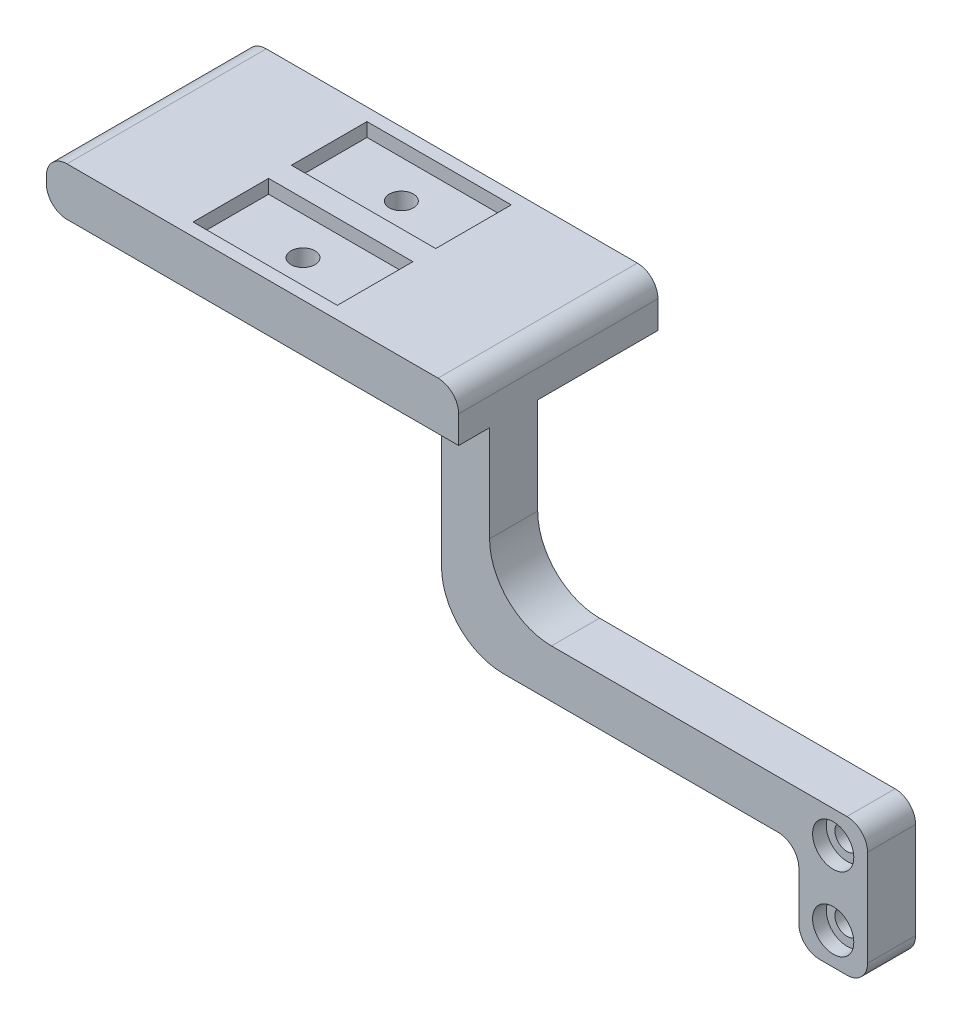
from build123d import *

# Parameters (mm, degrees)
SKIZZE1_R                       = 1.75
AUFSATZ_LINEAR_AUSTRAGEN1_DEPTH = 29
SKIZZE2_W                       = 95.177468056
SKIZZE2_H                       = 43
SCHNITT_LINEAR_AUSTRAGEN1_DEPTH = 29
SKIZZE5_W                       = 102.378587485
SKIZZE5_H                       = 44.26226899
SCHNITT_LINEAR_AUSTRAGEN2_DEPTH = 29
SKIZZE6_W                       = 21
SKIZZE6_H                       = 11
SCHNITT_LINEAR_AUSTRAGEN3_DEPTH = 2
SKIZZE7_R                       = 3
SCHNITT_LINEAR_AUSTRAGEN4_DEPTH = 2
SKIZZE8_R                       = 1.75
SCHNITT_LINEAR_AUSTRAGEN5_DEPTH = 102.965680501


with BuildPart() as part:
    # Skizze1 → Aufsatz-Linear austragen1 (new body)
    with BuildSketch(Plane.XY):
        with BuildLine():
            Line((31, -13.5), (31, 0.5))
            ThreePointArc((31, 0.5), (30.121320344, 2.621320344), (28, 3.5))
            Line((28, 3.5), (-15, 3.5))
            ThreePointArc((-15, 3.5), (-21.363961031, 6.136038969), (-24, 12.5))
            Line((-24, 12.5), (-24, 30.5))
            ThreePointArc((-24, 30.5), (-24.878679656, 32.621320344), (-27, 33.5))
            Line((-27, 33.5), (-81, 33.5))
            ThreePointArc((-81, 33.5), (-83.121320344, 32.621320344), (-84, 30.5))
            Line((-84, 30.5), (-84, 29.5))
            ThreePointArc((-84, 29.5), (-83.121320344, 27.378679656), (-81, 26.5))
            Line((-81, 26.5), (-36, 26.5))
            ThreePointArc((-36, 26.5), (-32.464466094, 25.035533906), (-31, 21.5))
            Line((-31, 21.5), (-31, 5.5))
            ThreePointArc((-31, 5.5), (-28.363961031, -0.863961031), (-22, -3.5))
            Line((-22, -3.5), (18, -3.5))
            ThreePointArc((18, -3.5), (20.121320344, -4.378679656), (21, -6.5))
            Line((21, -6.5), (21, -13.5))
            ThreePointArc((21, -13.5), (21.878679656, -15.621320344), (24, -16.5))
            Line((24, -16.5), (28, -16.5))
            ThreePointArc((28, -16.5), (30.121320344, -15.621320344), (31, -13.5))
        make_face()
        with Locations(Location((26, -1.150447614, 0), (0, 0, 180))):
            Circle(SKIZZE1_R, mode=Mode.SUBTRACT)
        with Locations(Location((26, -11.849552386, 0), (0, 0, 180))):
            Circle(SKIZZE1_R, mode=Mode.SUBTRACT)
    extrude(amount=AUFSATZ_LINEAR_AUSTRAGEN1_DEPTH)

    # Skizze2 → Schnitt-Linear austragen1 (cut)
    with BuildSketch(Plane.XY.offset(24.5)):
        with Locations((-3.395581908, 5)):
            Rectangle(SKIZZE2_W, SKIZZE2_H)
    extrude(amount=SCHNITT_LINEAR_AUSTRAGEN1_DEPTH, mode=Mode.SUBTRACT)

    # Skizze5 → Schnitt-Linear austragen2 (cut)
    with BuildSketch(Plane.XY.offset(17.5)):
        with Locations((-5.60029533, 4.368865505)):
            Rectangle(SKIZZE5_W, SKIZZE5_H)
    extrude(amount=-SCHNITT_LINEAR_AUSTRAGEN2_DEPTH, mode=Mode.SUBTRACT)

    # Skizze6 → Schnitt-Linear austragen3 (cut)
    with BuildSketch(Plane(origin=(0, 33.5, 0), x_dir=(1, 0, 0), z_dir=(0, 1, 0))):
        with Locations((-54, -7.342518692)):
            Rectangle(SKIZZE6_W, SKIZZE6_H)
        with Locations((-54, -21.657481308)):
            Rectangle(SKIZZE6_W, SKIZZE6_H)
    extrude(amount=-SCHNITT_LINEAR_AUSTRAGEN3_DEPTH, mode=Mode.SUBTRACT)

    # Skizze7 → Schnitt-Linear austragen4 (cut)
    with BuildSketch(Plane.XY.offset(24.5)):
        with Locations((26, -1.150447614)):
            Circle(SKIZZE7_R)
        with Locations((26, -11.849552386)):
            Circle(SKIZZE7_R)
    extrude(amount=-SCHNITT_LINEAR_AUSTRAGEN4_DEPTH, mode=Mode.SUBTRACT)

    # Skizze8 → Schnitt-Linear austragen5 (cut, through all)
    with BuildSketch(Plane(origin=(0, 33.5, 0), x_dir=(1, 0, 0), z_dir=(0, 1, 0))):
        with Locations(Location((-54, -7.342518692, 0), (0, 0, 270))):
            Circle(SKIZZE8_R)
        with Locations(Location((-54, -21.657481308, 0), (0, 0, 90))):
            Circle(SKIZZE8_R)
    extrude(amount=-SCHNITT_LINEAR_AUSTRAGEN5_DEPTH, mode=Mode.SUBTRACT)


solid = part.part
